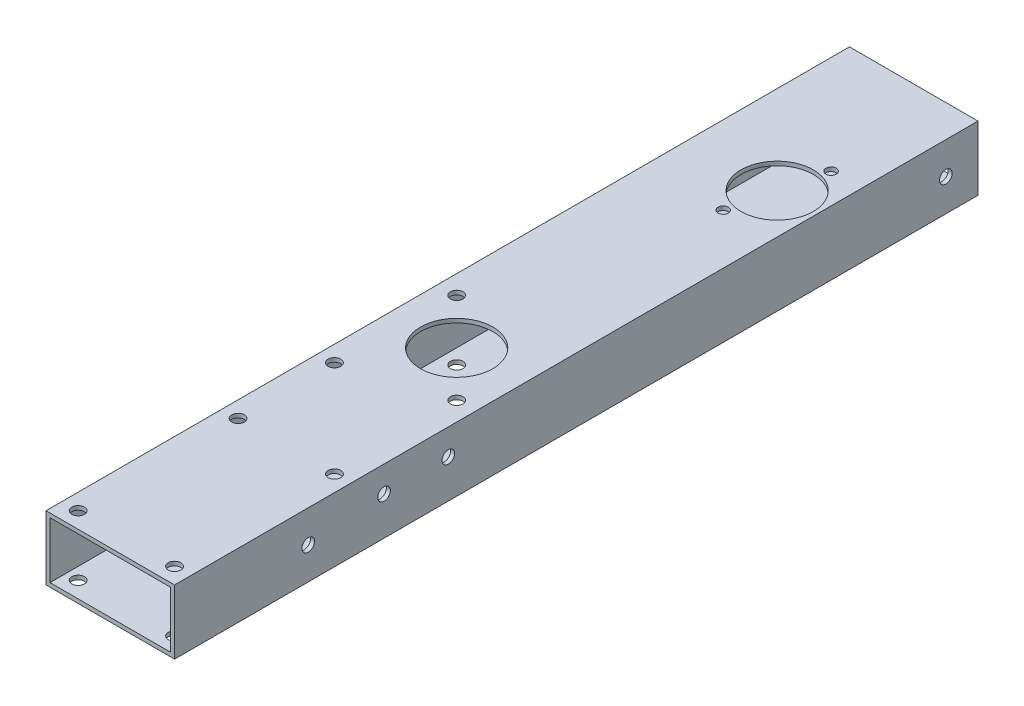
from build123d import *

# Parameters (mm, degrees)
BOSS_EXTRUDE1_DEPTH         = 158.750001
BOSS_EXTRUDE1_DEPTH_BACK    = 158.750001
SKETCH3_W                   = 50.8
SKETCH3_H                   = 25.4
SKETCH3_W_2                 = 47.625
SKETCH3_H_2                 = 22.225
SKETCH4_R                   = 14.2875
CUT_EXTRUDE1_DEPTH          = 39.37
F_10_CLEARANCE_HOLE1_D      = 4.9784
F_10_CLEARANCE_HOLE2_D      = 4.9784
F_10_CLEARANCE_HOLE3_D      = 4.9784
F_20_0_161_DIAMETER_HOLE1_D = 4.0894
F_10_CLEARANCE_HOLE4_D      = 4.9784
F_10_CLEARANCE_HOLE4_DEPTH  = 12.7
F_10_CLEARANCE_HOLE4_TIP    = 1.495662253


with BuildPart() as part:
    # Sketch3 → Boss-Extrude1 (new, two sides: drawn at the far end of the back side and taken through both)
    with BuildSketch(Plane.XY.offset(-BOSS_EXTRUDE1_DEPTH_BACK)):
        Rectangle(SKETCH3_W, SKETCH3_H)
        Rectangle(SKETCH3_W_2, SKETCH3_H_2, mode=Mode.SUBTRACT)
    extrude(amount=BOSS_EXTRUDE1_DEPTH + BOSS_EXTRUDE1_DEPTH_BACK)

    # Sketch4 → Cut-Extrude1 (cut)
    with BuildSketch(Plane(origin=(0, 12.7, 0), x_dir=(1, 0, 0), z_dir=(0, 1, 0))):
        with Locations(Location((9.525, 95.250000508, 0), (0, 0, 180))):
            Circle(SKETCH4_R)
        with Locations(Location((0, -21.863697987, 0), (0, 0, 180))):
            Circle(SKETCH4_R)
    extrude(amount=-CUT_EXTRUDE1_DEPTH, mode=Mode.SUBTRACT)

    # #10 Clearance Hole1 (through all)
    with Locations(Plane(origin=(0, 12.7, 0), x_dir=(1, 0, 0), z_dir=(0, 1, 0))):
        with Locations((-17.960512242, -3.903185745), (17.960512242, -39.824210229)):
            Hole(F_10_CLEARANCE_HOLE1_D / 2)

    # #10 Clearance Hole2 (through all)
    with Locations(Plane.ZY.offset(25.4)):
        with Locations((50.549668409, 2.425), (75.949668409, 2.425)):
            Hole(F_10_CLEARANCE_HOLE2_D / 2)

    # #10 Clearance Hole3 (through all)
    with Locations(Plane(origin=(0, 12.7, 0), x_dir=(1, 0, 0), z_dir=(0, 1, 0))):
        with Locations((-19.05, -51.113080493), (-19.05, -89.213080493), (19.05, -89.213080493), (19.05, -152.400000508), (-19.05, -152.400000508)):
            Hole(F_10_CLEARANCE_HOLE3_D / 2)

    # #20 (0.161) Diameter Hole1 (through all)
    with Locations(Plane(origin=(0, -12.7, 0), x_dir=(-1, 0, 0), z_dir=(0, -1, 0))):
        with Locations((-5.525370258, 77.925700755), (-13.524629742, 112.57430026)):
            Hole(F_20_0_161_DIAMETER_HOLE1_D / 2)

    # #10 Clearance Hole4
    with Locations(Plane(origin=(25.4, 0, 0), x_dir=(0, 0, -1), z_dir=(1, 0, 0))):
        with Locations((146.050000508, 0), (-105.917999492, 0)):
            Hole(F_10_CLEARANCE_HOLE4_D / 2, depth=F_10_CLEARANCE_HOLE4_DEPTH)
            with Locations((0, 0, -(F_10_CLEARANCE_HOLE4_DEPTH + F_10_CLEARANCE_HOLE4_TIP / 2))):  # 118° drill point
                Cone(0, F_10_CLEARANCE_HOLE4_D / 2, F_10_CLEARANCE_HOLE4_TIP, mode=Mode.SUBTRACT)


solid = part.part
